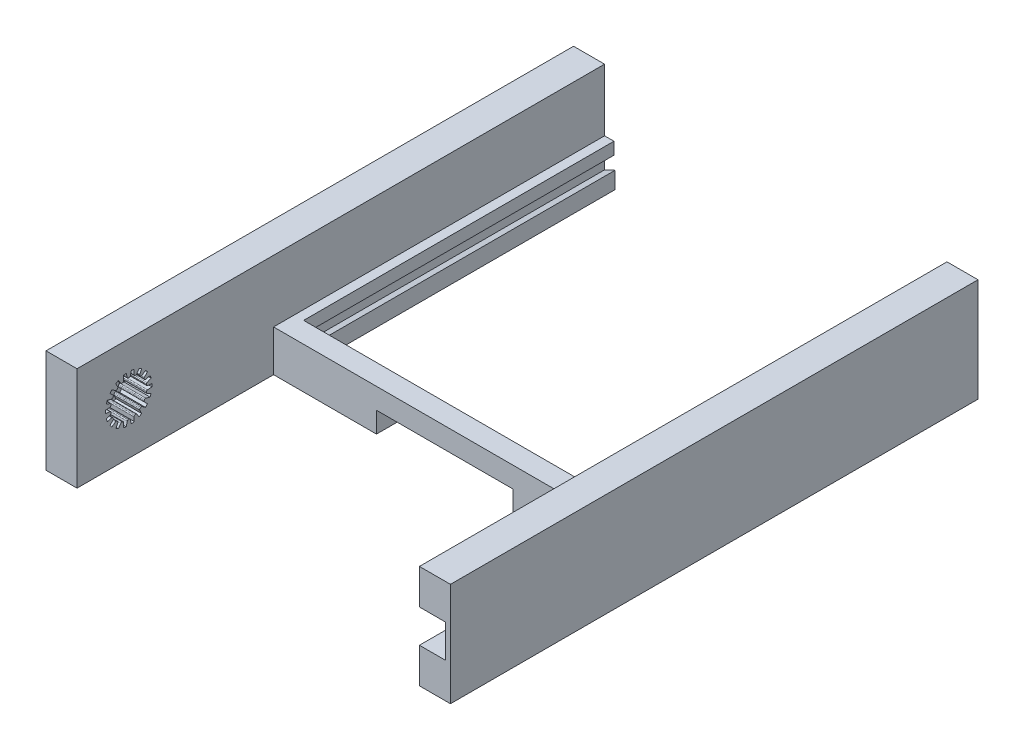
from build123d import *

# Parameters (mm, degrees)
SKETCH1_W             = 3
SKETCH1_H             = 51
BOSS_EXTRUDE1_DEPTH   = 10
BOSS_EXTRUDE1_2_DEPTH = 10
BOSS_EXTRUDE2_START   = -10
SKETCH2_W             = 33.1
SKETCH2_H             = 30
BOSS_EXTRUDE2_DEPTH   = 4
CUT_EXTRUDE1_START    = -10
SKETCH3_W             = 13.2
SKETCH3_H             = 30
CUT_EXTRUDE1_DEPTH    = 2
CUT_EXTRUDE2_START    = -3
CUT_EXTRUDE2_DEPTH    = 2.5
CUT_EXTRUDE3_START    = -36.1
SKETCH6_R             = 1.6
CUT_EXTRUDE3_DEPTH    = 2.5
CUT_EXTRUDE4_START    = -3.4
CUT_EXTRUDE4_DEPTH    = 3.2
CUT_EXTRUDE6_DEPTH    = 56.526592728
SKETCH11_W            = 33.1
SKETCH11_H            = 2
BOSS_EXTRUDE3_DEPTH   = 4
CUT_EXTRUDE7_START    = -4
SKETCH12_W            = 13.2
SKETCH12_H            = 2
CUT_EXTRUDE7_DEPTH    = 2


with BuildPart() as part:
    # Sketch1 → Boss-Extrude1 (new body)
    with BuildSketch(Plane(origin=(0, 0, 0), x_dir=(1, 0, 0), z_dir=(0, 1, 0))):
        with Locations((-18.05, 25.5)):
            Rectangle(SKETCH1_W, SKETCH1_H)
    extrude(amount=BOSS_EXTRUDE1_DEPTH)



with BuildPart() as body_2:
    # Sketch1 → Boss-Extrude1 2 (new body)
    with BuildSketch(Plane(origin=(0, 0, 0), x_dir=(1, 0, 0), z_dir=(0, 1, 0))):
        with Locations((18.05, 25.5)):
            Rectangle(SKETCH1_W, SKETCH1_H)
    extrude(amount=BOSS_EXTRUDE1_2_DEPTH)


with BuildPart() as part_1:
    add(part.part)

    add(body_2.part)  # Boss-Extrude2 merges body 2
    # Sketch2 → Boss-Extrude2 (add)
    with BuildSketch(Plane(origin=(0, 10, 0), x_dir=(1, 0, 0), z_dir=(0, 1, 0)).offset(BOSS_EXTRUDE2_START)):
        with Locations((0, 36)):
            Rectangle(SKETCH2_W, SKETCH2_H)
    extrude(amount=BOSS_EXTRUDE2_DEPTH)

    # Sketch3 → Cut-Extrude1 (cut)
    with BuildSketch(Plane(origin=(0, 10, 0), x_dir=(1, 0, 0), z_dir=(0, 1, 0)).offset(CUT_EXTRUDE1_START)):
        with Locations((0, 36)):
            Rectangle(SKETCH3_W, SKETCH3_H)
    extrude(amount=CUT_EXTRUDE1_DEPTH, mode=Mode.SUBTRACT)

    # Sketch5 → Cut-Extrude2 (cut)
    with BuildSketch(Plane.ZY.offset(19.55).offset(CUT_EXTRUDE2_START)):
        with BuildLine():
            Line((-4.75, 7.236067977), (-4.854831539, 6.824677172))
            ThreePointArc((-4.854831539, 6.824677172), (-4.891407754, 6.769616655), (-4.954343768, 6.74940433))
            ThreePointArc((-4.954343768, 6.74940433), (-5, 6.75), (-5.045656232, 6.74940433))
            ThreePointArc((-5.045656232, 6.74940433), (-5.108592246, 6.769616655), (-5.145168461, 6.824677172))
            Line((-5.145168461, 6.824677172), (-5.25, 7.236067977))
            ThreePointArc((-5.25, 7.236067977), (-5.3907084, 7.215817444), (-5.529857135, 7.186721614))
            Line((-5.529857135, 7.186721614), (-5.487662617, 6.764286212))
            ThreePointArc((-5.487662617, 6.764286212), (-5.503201209, 6.700036448), (-5.555428696, 6.65951769))
            ThreePointArc((-5.555428696, 6.65951769), (-5.598535251, 6.644462086), (-5.641234343, 6.628286988))
            ThreePointArc((-5.641234343, 6.628286988), (-5.707287874, 6.625754976), (-5.760490079, 6.664985136))
            Line((-5.760490079, 6.664985136), (-5.999703445, 7.015711542))
            ThreePointArc((-5.999703445, 7.015711542), (-6.125, 6.948557159), (-6.24580568, 6.873624351))
            Line((-6.24580568, 6.873624351), (-6.061674385, 6.491096296))
            ThreePointArc((-6.061674385, 6.491096296), (-6.054301173, 6.425406755), (-6.089520725, 6.369468725))
            ThreePointArc((-6.089520725, 6.369468725), (-6.124878317, 6.340577775), (-6.15947013, 6.310774205))
            ThreePointArc((-6.15947013, 6.310774205), (-6.220674146, 6.285803254), (-6.28408537, 6.30447132))
            Line((-6.28408537, 6.30447132), (-6.628827901, 6.552230546))
            ThreePointArc((-6.628827901, 6.552230546), (-6.723599997, 6.446272122), (-6.811491673, 6.33454034))
            Line((-6.811491673, 6.33454034), (-6.507632554, 6.038058161))
            ThreePointArc((-6.507632554, 6.038058161), (-6.478236855, 5.978851971), (-6.492200475, 5.914241621))
            ThreePointArc((-6.492200475, 5.914241621), (-6.515544457, 5.875), (-6.537856707, 5.835162708))
            ThreePointArc((-6.537856707, 5.835162708), (-6.586829101, 5.790764683), (-6.652801015, 5.786619011))
            Line((-6.652801015, 5.786619011), (-7.061491673, 5.901527638))
            ThreePointArc((-7.061491673, 5.901527638), (-7.114308397, 5.769545322), (-7.158685036, 5.634491068))
            Line((-7.158685036, 5.634491068), (-6.771747987, 5.459814891))
            ThreePointArc((-6.771747987, 5.459814891), (-6.723875356, 5.414233193), (-6.714898826, 5.348743485))
            ThreePointArc((-6.714898826, 5.348743485), (-6.723413568, 5.303884311), (-6.730755068, 5.258818263))
            ThreePointArc((-6.730755068, 5.258818263), (-6.761589047, 5.200348221), (-6.822164464, 5.17388884))
            Line((-6.822164464, 5.17388884), (-7.245509125, 5.142087191))
            ThreePointArc((-7.245509125, 5.142087191), (-7.25, 5), (-7.245509125, 4.857912809))
            Line((-7.245509125, 4.857912809), (-6.822164464, 4.82611116))
            ThreePointArc((-6.822164464, 4.82611116), (-6.761589047, 4.799651779), (-6.730755068, 4.741181737))
            ThreePointArc((-6.730755068, 4.741181737), (-6.723413568, 4.696115689), (-6.714898826, 4.651256515))
            ThreePointArc((-6.714898826, 4.651256515), (-6.723875356, 4.585766807), (-6.771747987, 4.540185109))
            Line((-6.771747987, 4.540185109), (-7.158685036, 4.365508932))
            ThreePointArc((-7.158685036, 4.365508932), (-7.114308397, 4.230454678), (-7.061491673, 4.098472362))
            Line((-7.061491673, 4.098472362), (-6.652801015, 4.213380989))
            ThreePointArc((-6.652801015, 4.213380989), (-6.586829101, 4.209235317), (-6.537856707, 4.164837292))
            ThreePointArc((-6.537856707, 4.164837292), (-6.515544457, 4.125), (-6.492200475, 4.085758379))
            ThreePointArc((-6.492200475, 4.085758379), (-6.478236855, 4.021148029), (-6.507632554, 3.961941839))
            Line((-6.507632554, 3.961941839), (-6.811491673, 3.66545966))
            ThreePointArc((-6.811491673, 3.66545966), (-6.723599997, 3.553727878), (-6.628827901, 3.447769454))
            Line((-6.628827901, 3.447769454), (-6.28408537, 3.69552868))
            ThreePointArc((-6.28408537, 3.69552868), (-6.220674146, 3.714196746), (-6.15947013, 3.689225795))
            ThreePointArc((-6.15947013, 3.689225795), (-6.124878317, 3.659422225), (-6.089520725, 3.630531275))
            ThreePointArc((-6.089520725, 3.630531275), (-6.054301173, 3.574593245), (-6.061674385, 3.508903704))
            Line((-6.061674385, 3.508903704), (-6.24580568, 3.126375649))
            ThreePointArc((-6.24580568, 3.126375649), (-6.125, 3.051442841), (-5.999703445, 2.984288458))
            Line((-5.999703445, 2.984288458), (-5.760490079, 3.335014864))
            ThreePointArc((-5.760490079, 3.335014864), (-5.707287874, 3.374245024), (-5.641234343, 3.371713012))
            ThreePointArc((-5.641234343, 3.371713012), (-5.598535251, 3.355537914), (-5.555428696, 3.34048231))
            ThreePointArc((-5.555428696, 3.34048231), (-5.503201209, 3.299963552), (-5.487662617, 3.235713788))
            Line((-5.487662617, 3.235713788), (-5.529857135, 2.813278386))
            ThreePointArc((-5.529857135, 2.813278386), (-5.3907084, 2.784182556), (-5.25, 2.763932023))
            Line((-5.25, 2.763932023), (-5.145168461, 3.175322828))
            ThreePointArc((-5.145168461, 3.175322828), (-5.108592246, 3.230383345), (-5.045656232, 3.25059567))
            ThreePointArc((-5.045656232, 3.25059567), (-5, 3.25), (-4.954343768, 3.25059567))
            ThreePointArc((-4.954343768, 3.25059567), (-4.891407754, 3.230383345), (-4.854831539, 3.175322828))
            Line((-4.854831539, 3.175322828), (-4.75, 2.763932023))
            ThreePointArc((-4.75, 2.763932023), (-4.6092916, 2.784182556), (-4.470142865, 2.813278386))
            Line((-4.470142865, 2.813278386), (-4.512337383, 3.235713788))
            ThreePointArc((-4.512337383, 3.235713788), (-4.496798791, 3.299963552), (-4.444571304, 3.34048231))
            ThreePointArc((-4.444571304, 3.34048231), (-4.401464749, 3.355537914), (-4.358765657, 3.371713012))
            ThreePointArc((-4.358765657, 3.371713012), (-4.292712126, 3.374245024), (-4.239509921, 3.335014864))
            Line((-4.239509921, 3.335014864), (-4.000296555, 2.984288458))
            ThreePointArc((-4.000296555, 2.984288458), (-3.875, 3.051442841), (-3.75419432, 3.126375649))
            Line((-3.75419432, 3.126375649), (-3.938325615, 3.508903704))
            ThreePointArc((-3.938325615, 3.508903704), (-3.945698827, 3.574593245), (-3.910479275, 3.630531275))
            ThreePointArc((-3.910479275, 3.630531275), (-3.875121683, 3.659422225), (-3.84052987, 3.689225795))
            ThreePointArc((-3.84052987, 3.689225795), (-3.779325854, 3.714196746), (-3.71591463, 3.69552868))
            Line((-3.71591463, 3.69552868), (-3.371172099, 3.447769454))
            ThreePointArc((-3.371172099, 3.447769454), (-3.276400003, 3.553727878), (-3.188508327, 3.66545966))
            Line((-3.188508327, 3.66545966), (-3.492367446, 3.961941839))
            ThreePointArc((-3.492367446, 3.961941839), (-3.521763145, 4.021148029), (-3.507799525, 4.085758379))
            ThreePointArc((-3.507799525, 4.085758379), (-3.484455543, 4.125), (-3.462143293, 4.164837292))
            ThreePointArc((-3.462143293, 4.164837292), (-3.413170899, 4.209235317), (-3.347198985, 4.213380989))
            Line((-3.347198985, 4.213380989), (-2.938508327, 4.098472362))
            ThreePointArc((-2.938508327, 4.098472362), (-2.885691603, 4.230454678), (-2.841314964, 4.365508932))
            Line((-2.841314964, 4.365508932), (-3.228252013, 4.540185109))
            ThreePointArc((-3.228252013, 4.540185109), (-3.276124644, 4.585766807), (-3.285101174, 4.651256515))
            ThreePointArc((-3.285101174, 4.651256515), (-3.276586432, 4.696115689), (-3.269244932, 4.741181737))
            ThreePointArc((-3.269244932, 4.741181737), (-3.238410953, 4.799651779), (-3.177835536, 4.82611116))
            Line((-3.177835536, 4.82611116), (-2.754490875, 4.857912809))
            ThreePointArc((-2.754490875, 4.857912809), (-2.75, 5), (-2.754490875, 5.142087191))
            Line((-2.754490875, 5.142087191), (-3.177835536, 5.17388884))
            ThreePointArc((-3.177835536, 5.17388884), (-3.238410953, 5.200348221), (-3.269244932, 5.258818263))
            ThreePointArc((-3.269244932, 5.258818263), (-3.276586432, 5.303884311), (-3.285101174, 5.348743485))
            ThreePointArc((-3.285101174, 5.348743485), (-3.276124644, 5.414233193), (-3.228252013, 5.459814891))
            Line((-3.228252013, 5.459814891), (-2.841314964, 5.634491068))
            ThreePointArc((-2.841314964, 5.634491068), (-2.885691603, 5.769545322), (-2.938508327, 5.901527638))
            Line((-2.938508327, 5.901527638), (-3.347198985, 5.786619011))
            ThreePointArc((-3.347198985, 5.786619011), (-3.413170899, 5.790764683), (-3.462143293, 5.835162708))
            ThreePointArc((-3.462143293, 5.835162708), (-3.484455543, 5.875), (-3.507799525, 5.914241621))
            ThreePointArc((-3.507799525, 5.914241621), (-3.521763145, 5.978851971), (-3.492367446, 6.038058161))
            Line((-3.492367446, 6.038058161), (-3.188508327, 6.33454034))
            ThreePointArc((-3.188508327, 6.33454034), (-3.276400003, 6.446272122), (-3.371172099, 6.552230546))
            Line((-3.371172099, 6.552230546), (-3.71591463, 6.30447132))
            ThreePointArc((-3.71591463, 6.30447132), (-3.779325854, 6.285803254), (-3.84052987, 6.310774205))
            ThreePointArc((-3.84052987, 6.310774205), (-3.875121683, 6.340577775), (-3.910479275, 6.369468725))
            ThreePointArc((-3.910479275, 6.369468725), (-3.945698827, 6.425406755), (-3.938325615, 6.491096296))
            Line((-3.938325615, 6.491096296), (-3.75419432, 6.873624351))
            ThreePointArc((-3.75419432, 6.873624351), (-3.875, 6.948557159), (-4.000296555, 7.015711542))
            Line((-4.000296555, 7.015711542), (-4.239509921, 6.664985136))
            ThreePointArc((-4.239509921, 6.664985136), (-4.292712126, 6.625754976), (-4.358765657, 6.628286988))
            ThreePointArc((-4.358765657, 6.628286988), (-4.401464749, 6.644462086), (-4.444571304, 6.65951769))
            ThreePointArc((-4.444571304, 6.65951769), (-4.496798791, 6.700036448), (-4.512337383, 6.764286212))
            Line((-4.512337383, 6.764286212), (-4.470142865, 7.186721614))
            ThreePointArc((-4.470142865, 7.186721614), (-4.6092916, 7.215817444), (-4.75, 7.236067977))
        make_face()
    extrude(amount=CUT_EXTRUDE2_DEPTH, mode=Mode.SUBTRACT)

    # Sketch6 → Cut-Extrude3 (cut)
    with BuildSketch(Plane.ZY.offset(19.55).offset(CUT_EXTRUDE3_START)):
        with Locations(Location((-5, 5, 0), (0, 0, 180))):
            Circle(SKETCH6_R)
    extrude(amount=-CUT_EXTRUDE3_DEPTH, mode=Mode.SUBTRACT)

    # Sketch9 → Cut-Extrude4 (cut)
    with BuildSketch(Plane(origin=(0, 10, 0), x_dir=(1, 0, 0), z_dir=(0, 1, 0)).offset(CUT_EXTRUDE4_START)):
        Polygon((16.55, 5), (17.55, 5), (19.05, 0), (16.55, 0), align=None)
    extrude(amount=-CUT_EXTRUDE4_DEPTH, mode=Mode.SUBTRACT)

    # Sketch10 → Cut-Extrude6 (cut, through all)
    with BuildSketch(Plane(origin=(0, 0, -51), x_dir=(-1, 0, 0), z_dir=(0, 0, -1))):
        Polygon((-15.644123368, 2.827582789), (-16.55, 3.25), (-16.55, 1.15), (-15.534888499, 1.623354267), (-15.534888499, -2.247783868), (15.534888499, -2.247783868), (15.534888499, 1.623354267), (16.55, 1.15), (16.55, 3.25), (15.644123368, 2.827582789), (15.644123368, 10.774284902), (-15.644123368, 10.774284902), align=None)
    extrude(amount=-CUT_EXTRUDE6_DEPTH, mode=Mode.SUBTRACT)


with BuildPart() as cut_extrude6_piece_1:
    # of the separate pieces the step leaves, piece 1, a body of its own (cut_extrude6_pieces)
    add(part_1.part.solids().sort_by_distance((-15.534888499, 0, -51))[0])



with BuildPart() as cut_extrude6_piece_2:
    # of the separate pieces the step leaves, piece 2, a body of its own (cut_extrude6_pieces)
    add(part_1.part.solids().sort_by_distance((19.55, 0, -51))[0])


with BuildPart() as cut_extrude6_piece_1_1:
    add(cut_extrude6_piece_1.part)

    add(cut_extrude6_piece_2.part)  # Boss-Extrude3 merges Cut-Extrude6 piece 2
    # Sketch11 → Boss-Extrude3 (add)
    with BuildSketch(Plane(origin=(0, 0, 0), x_dir=(1, 0, 0), z_dir=(0, 1, 0))):
        with Locations((0, 20)):
            Rectangle(SKETCH11_W, SKETCH11_H)
    extrude(amount=BOSS_EXTRUDE3_DEPTH)

    # Sketch12 → Cut-Extrude7 (cut)
    with BuildSketch(Plane(origin=(0, 4, 0), x_dir=(1, 0, 0), z_dir=(0, 1, 0)).offset(CUT_EXTRUDE7_START)):
        with Locations((0, 20)):
            Rectangle(SKETCH12_W, SKETCH12_H)
    extrude(amount=CUT_EXTRUDE7_DEPTH, mode=Mode.SUBTRACT)


solid = cut_extrude6_piece_1_1.part
